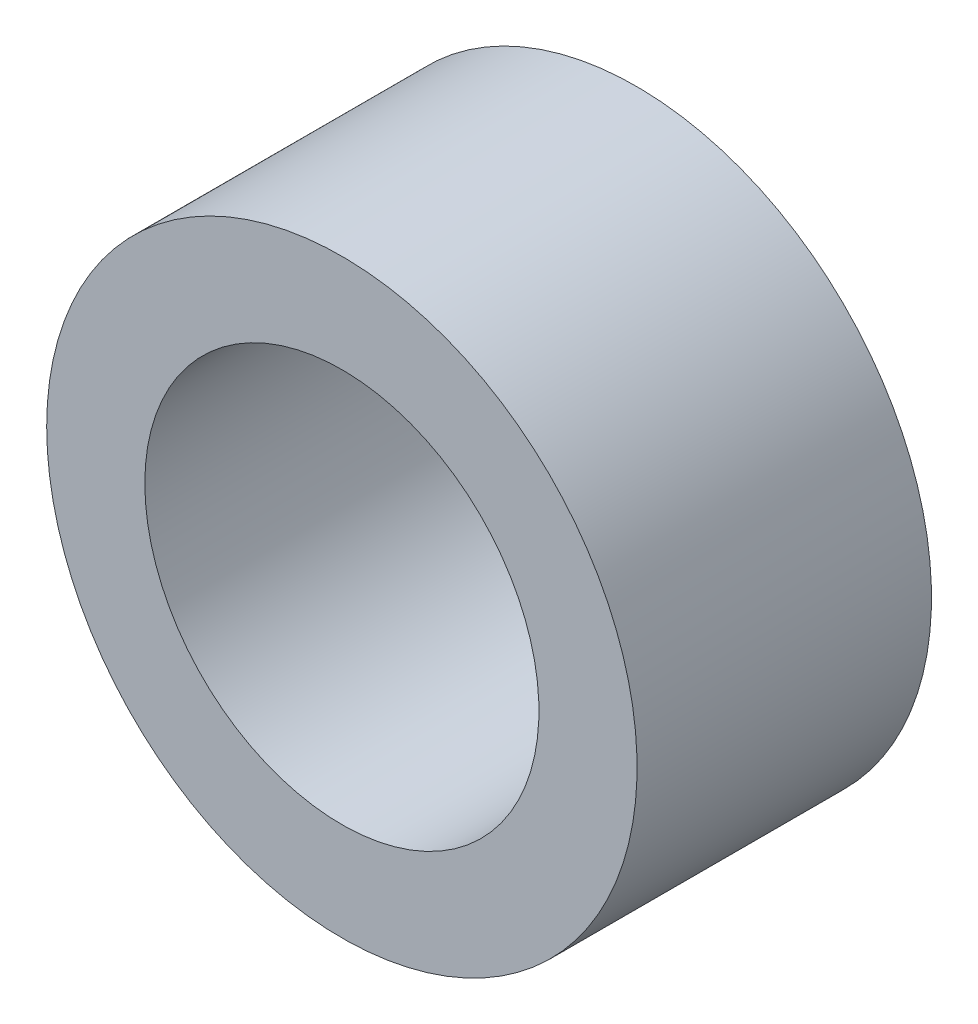
from build123d import *

# Parameters (mm, degrees)
SKETCH1_R      = 9.5504
SKETCH1_R_2    = 6.3754
EXTRUDE1_DEPTH = 4.7625


with BuildPart() as part:
    # Sketch1 → Extrude1 (new, symmetric)
    with BuildSketch(Plane.XY):
        with Locations(Location((0, 0, 0), (0, 0, 180))):
            Circle(SKETCH1_R)
        with Locations(Location((0, 0, 0), (0, 0, 180))):
            Circle(SKETCH1_R_2, mode=Mode.SUBTRACT)
    extrude(amount=EXTRUDE1_DEPTH, both=True)


solid = part.part
